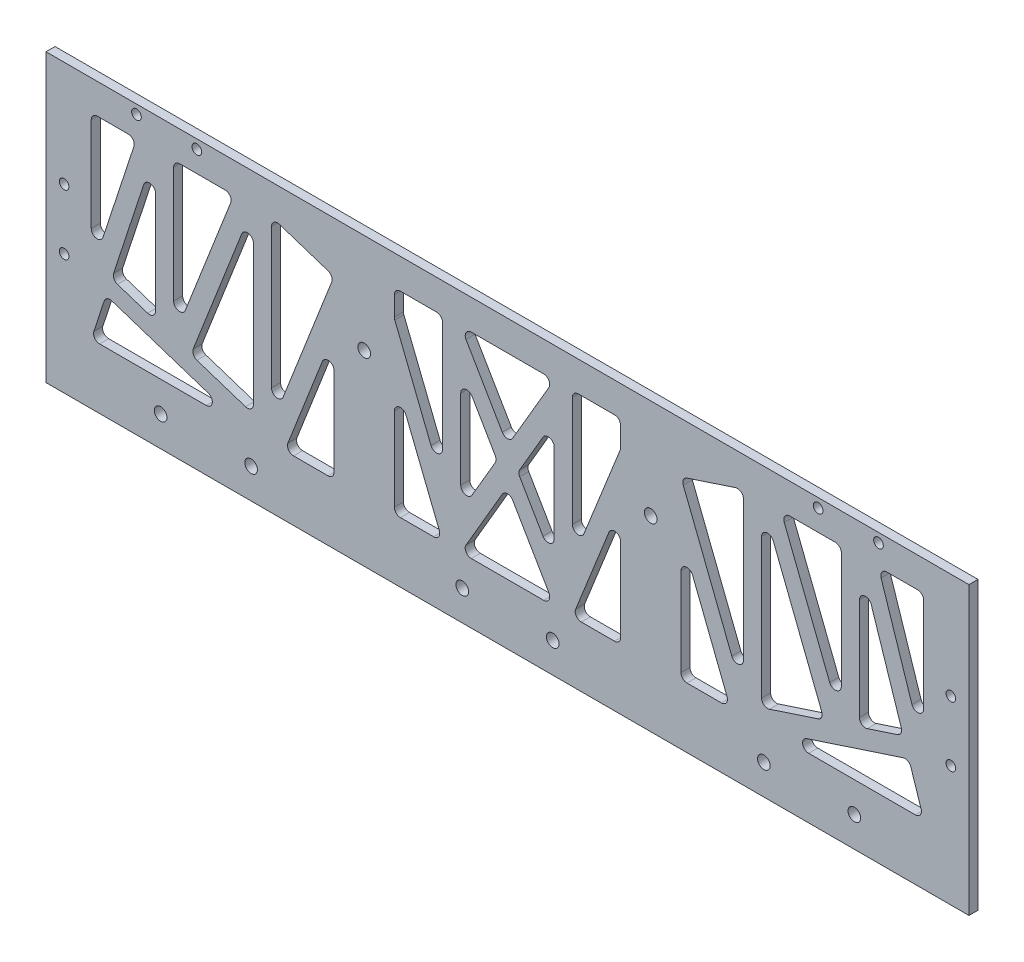
from build123d import *

# Parameters (mm, degrees)
SKETCH_1_W              = 306
SKETCH_1_H              = 95
EXTRUDE_1_DEPTH         = 3
HOLE_WIZARD_4_2_4_2_1_D = 4.2
CUT_EXTRUDE_1_DEPTH     = 181.11940484
FILLET_2_R              = 2
FILLET_2_OF_MIRROR_1_R  = 2
CUT_EXTRUDE_2_DEPTH     = 181.11940484
FILLET_3_R              = 2
HOLE_WIZARD_4_2_4_2_2_D = 4.2
HOLE_WIZARD_4_2_4_2_3_D = 4.2
HOLE_WIZARD_3_2_3_2_1_D = 3.2
HOLE_WIZARD_3_2_3_2_2_D = 3.2


with BuildPart() as part:
    # 草图1 → 凸台-拉伸1 (new body)
    with BuildSketch(Plane.XY):
        with Locations((0, 47.5)):
            Rectangle(SKETCH_1_W, SKETCH_1_H)
    extrude(amount=EXTRUDE_1_DEPTH)

    # Ø4.2 (4.2) 直径孔1 (through all)
    with Locations(Plane(origin=(-47.5, 62, 3), x_dir=(1, 0, 0), z_dir=(0, 0, 1))):
        with Locations((0, 0), (95, 0)):
            Hole(HOLE_WIZARD_4_2_4_2_1_D / 2)

    # 草图4 → 切除-拉伸1 (cut, through all)
    with BuildSketch(Plane.XY.offset(3)):
        Polygon((-138, 20), (-133.081304682, 35), (-87.337467047, 20), align=None)
        Polygon((-138, 85), (-138, 39.256162365), (-123, 85), align=None)
        Polygon((-131.211773292, 40.701302692), (-116.685653622, 85), (-116.685653622, 35.937998904), align=None)
        Polygon((-110.685653622, 85), (-110.685653622, 33.970520777), (-90.685653622, 85), align=None)
        Polygon((-104.975185096, 32.09798379), (-84.24128108, 25.299066683), (-84.24128108, 85), align=None)
        Polygon((-78.24128108, 85), (-78.24128108, 25.299066683), (-57.507377064, 78.201082893), align=None)
        Polygon((-57.5, 61.777256543), (-57.5, 20), (-73.873773426, 20), align=None)
    cut_extrude_1 = extrude(amount=-CUT_EXTRUDE_1_DEPTH, mode=Mode.SUBTRACT)

    # 圆角2
    fillet_2_edges = [part.edges().sort_by_distance(p)[0] for p in [
        (-78.24128108, 85, 1.5),
        (-57.507377064, 78.201082893, 1.5),
        (-78.24128108, 25.299066683, 1.5),
        (-57.5, 20, 1.5),
        (-73.873773426, 20, 1.5),
        (-57.5, 61.777256543, 1.5),
        (-87.337467047, 20, 1.5),
        (-138, 20, 1.5),
        (-133.081304682, 35, 1.5),
        (-84.24128108, 85, 1.5),
        (-84.24128108, 25.299066683, 1.5),
        (-104.975185096, 32.09798379, 1.5),
        (-116.685653622, 85, 1.5),
        (-116.685653622, 35.937998904, 1.5),
        (-131.211773292, 40.701302692, 1.5),
        (-90.685653622, 85, 1.5),
        (-110.685653622, 33.970520777, 1.5),
        (-110.685653622, 85, 1.5),
        (-123, 85, 1.5),
        (-138, 39.256162365, 1.5),
        (-138, 85, 1.5),
    ]]
    fillet(fillet_2_edges, radius=FILLET_2_R)

    # 镜向1: 切除-拉伸1 across plane
    add(cut_extrude_1.mirror(Plane(origin=(0, 0, 0), x_dir=(0, 0, 1), z_dir=(1, 0, 0))), mode=Mode.SUBTRACT)

    # 圆角2 of 镜向1
    fillet_2_of_mirror_1_edges = [part.edges().sort_by_distance(p)[0] for p in [
        (78.24128108, 85, 1.5),
        (57.507377064, 78.201082893, 1.5),
        (78.24128108, 25.299066683, 1.5),
        (57.5, 20, 1.5),
        (73.873773426, 20, 1.5),
        (57.5, 61.777256543, 1.5),
        (87.337467047, 20, 1.5),
        (138, 20, 1.5),
        (133.081304682, 35, 1.5),
        (84.24128108, 85, 1.5),
        (84.24128108, 25.299066683, 1.5),
        (104.975185096, 32.09798379, 1.5),
        (116.685653622, 85, 1.5),
        (116.685653622, 35.937998904, 1.5),
        (131.211773292, 40.701302692, 1.5),
        (90.685653622, 85, 1.5),
        (110.685653622, 33.970520777, 1.5),
        (110.685653622, 85, 1.5),
        (123, 85, 1.5),
        (138, 39.256162365, 1.5),
        (138, 85, 1.5),
    ]]
    fillet(fillet_2_of_mirror_1_edges, radius=FILLET_2_OF_MIRROR_1_R)

    # 草图5 → 切除-拉伸2 (cut, through all)
    with BuildSketch(Plane.XY.offset(3)):
        Polygon((-15.5, 73.099447473), (-15.5, 31.900552527), (-3.473832082, 52.5), align=None)
        Polygon((-37.5, 85), (-37.5, 76.155494421), (-21.5, 36.155494421), (-21.5, 85), align=None)
        Polygon((-37.5, 20), (-21.5, 20), (-37.5, 60), align=None)
        Polygon((-15.5, 20), (15.5, 20), (0, 46.549723736), align=None)
        Polygon((21.5, 85), (21.5, 36.155494421), (37.5, 76.155494421), (37.5, 85), align=None)
        Polygon((37.5, 60), (37.5, 20), (21.5, 20), align=None)
        Polygon((-15.5, 85), (15.5, 85), (0, 58.450276264), align=None)
        Polygon((15.5, 73.099447473), (15.5, 31.900552527), (3.473832082, 52.5), align=None)
    extrude(amount=-CUT_EXTRUDE_2_DEPTH, mode=Mode.SUBTRACT)

    # 圆角3
    fillet_3_edges = [part.edges().sort_by_distance(p)[0] for p in [
        (21.5, 85, 1.5),
        (37.5, 85, 1.5),
        (37.5, 76.155494421, 1.5),
        (21.5, 36.155494421, 1.5),
        (0, 46.549723736, 1.5),
        (15.5, 20, 1.5),
        (-15.5, 20, 1.5),
        (-15.5, 73.099447473, 1.5),
        (-3.473832082, 52.5, 1.5),
        (-15.5, 31.900552527, 1.5),
        (-37.5, 20, 1.5),
        (-37.5, 60, 1.5),
        (-21.5, 20, 1.5),
        (15.5, 31.900552527, 1.5),
        (3.473832082, 52.5, 1.5),
        (15.5, 73.099447473, 1.5),
        (0, 58.450276264, 1.5),
        (-15.5, 85, 1.5),
        (15.5, 85, 1.5),
        (21.5, 20, 1.5),
        (37.5, 60, 1.5),
        (37.5, 20, 1.5),
        (-37.5, 85, 1.5),
        (-21.5, 85, 1.5),
        (-21.5, 36.155494421, 1.5),
        (-37.5, 76.155494421, 1.5),
    ]]
    fillet(fillet_3_edges, radius=FILLET_3_R)

    # Ø4.2 (4.2) 直径孔2 (through all)
    with Locations(Plane(origin=(115, 10, 3), x_dir=(1, 0, 0), z_dir=(0, 0, 1))):
        with Locations((0, 0), (-30, 0)):
            hole_wizard_4_2_4_2_2 = Hole(HOLE_WIZARD_4_2_4_2_2_D / 2)

    # 镜向2: Ø4.2 (4.2) 直径孔2 across plane
    add(hole_wizard_4_2_4_2_2.mirror(Plane(origin=(0, 0, 0), x_dir=(0, 0, 1), z_dir=(1, 0, 0))), mode=Mode.SUBTRACT)

    # Ø4.2 (4.2) 直径孔3 (through all)
    with Locations(Plane(origin=(-15, 10, 3), x_dir=(1, 0, 0), z_dir=(0, 0, 1))):
        with Locations((0, 0), (30, 0)):
            Hole(HOLE_WIZARD_4_2_4_2_3_D / 2)

    # Ø3.2 (3.2) 直径孔1 (through all)
    with Locations(Plane(origin=(147, 60, 3), x_dir=(1, 0, 0), z_dir=(0, 0, 1))):
        with Locations((0, 0), (0, -20)):
            hole_wizard_3_2_3_2_1 = Hole(HOLE_WIZARD_3_2_3_2_1_D / 2)

    # 镜向3: Ø3.2 (3.2) 直径孔1 across plane
    add(hole_wizard_3_2_3_2_1.mirror(Plane(origin=(0, 0, 0), x_dir=(0, 0, 1), z_dir=(1, 0, 0))), mode=Mode.SUBTRACT)

    # Ø3.2 (3.2) 直径孔2 (through all)
    with Locations(Plane(origin=(-123, 92, 3), x_dir=(1, 0, 0), z_dir=(0, 0, 1))):
        with Locations((0, 0), (20, 0)):
            hole_wizard_3_2_3_2_2 = Hole(HOLE_WIZARD_3_2_3_2_2_D / 2)

    # 镜向4: Ø3.2 (3.2) 直径孔2 across plane
    add(hole_wizard_3_2_3_2_2.mirror(Plane(origin=(0, 0, 0), x_dir=(0, 0, 1), z_dir=(1, 0, 0))), mode=Mode.SUBTRACT)


solid = part.part
